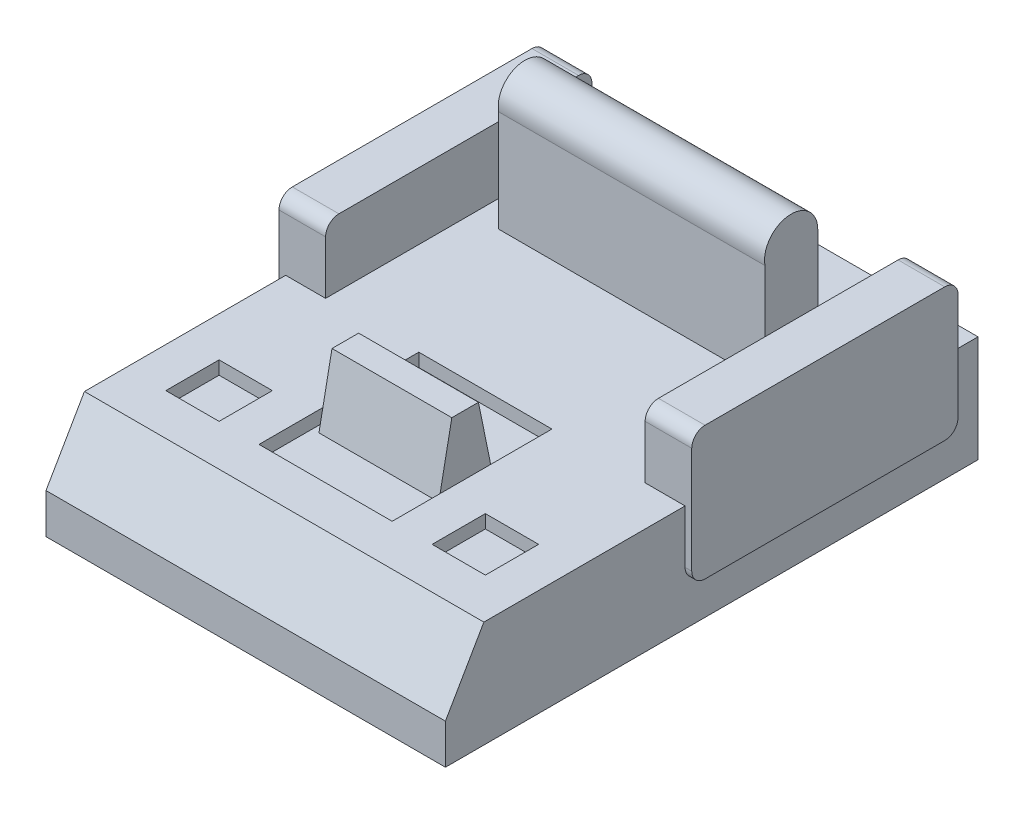
from build123d import *

# Parameters (mm, degrees)
SKETCH_1_W           = 30
SKETCH_1_H           = 40
EXTRUDE_1_DEPTH      = 8
CHAMFER_1_SIZE       = 5
CHAMFER_1_SIZE2      = 2.886751346
EXTRUDE_START        = -3
EXTRUDE_2_DEPTH      = 3.5
EXTRUDE_3_DEPTH      = 10
EXTRUDE_3_DEPTH_BACK = 10
SKETCH_4_W           = 4
SKETCH_4_H           = 4
CUT_EXTRUDE_2_DEPTH  = 1
SKETCH_12_W          = 10
SKETCH_12_H          = 12
CUT_EXTRUDE_3_DEPTH  = 1


with BuildPart() as part:
    # 草图1 → 凸台-拉伸1 (new body)
    with BuildSketch(Plane(origin=(0, 0, 0), x_dir=(1, 0, 0), z_dir=(0, 1, 0))):
        Rectangle(SKETCH_1_W, SKETCH_1_H)
    extrude(amount=EXTRUDE_1_DEPTH)

    # 倒角1
    chamfer_1_edges = [part.edges().sort_by_distance(p)[0] for p in [
        (0, 8, 20),
    ]]
    chamfer_1_side = [part.faces().sort_by_distance(p)[0] for p in [
        (0, 4, 20),
    ]]
    chamfer(chamfer_1_edges, length=CHAMFER_1_SIZE, length2=CHAMFER_1_SIZE2, reference=chamfer_1_side[0])

    # 草图6 → 凸台-拉伸2 (add)
    with BuildSketch(Plane(origin=(15, 0, 0), x_dir=(0, 0, -1), z_dir=(1, 0, 0)).offset(EXTRUDE_START)):
        with BuildLine():
            Line((18, 12), (18, 4))
            ThreePointArc((18, 4), (17.707106781, 3.292893219), (17, 3))
            Line((17, 3), (-1, 3))
            ThreePointArc((-1, 3), (-1.707106781, 3.292893219), (-2, 4))
            Line((-2, 4), (-2, 12))
            ThreePointArc((-2, 12), (-1.707106781, 12.707106781), (-1, 13))
            Line((-1, 13), (17, 13))
            ThreePointArc((17, 13), (17.707106781, 12.707106781), (18, 12))
        make_face()
    extrude_2 = extrude(amount=EXTRUDE_2_DEPTH)

    # 镜向2: 凸台-拉伸2 across plane
    add(extrude_2.mirror(Plane(origin=(0, 0, 0), x_dir=(0, 0, 1), z_dir=(1, 0, 0))))

    # 草图10 → 凸台-拉伸3 (add, two sides: drawn at the far end of the back side and taken through both)
    with BuildSketch(Plane(origin=(0, 0, 0), x_dir=(0, 0, -1), z_dir=(1, 0, 0)).offset(-EXTRUDE_3_DEPTH_BACK)):
        with BuildLine():
            Line((9, 8), (9, 15.630981347))
            ThreePointArc((9, 15.630981347), (10.780355092, 17.991396878), (12.965661526, 16))
            Line((12.965661526, 16), (12.965661526, 8))
            Line((12.965661526, 8), (9, 8))
        make_face()
    extrude(amount=EXTRUDE_3_DEPTH + EXTRUDE_3_DEPTH_BACK)

    # 草图4 → 切除-拉伸2 (cut)
    with BuildSketch(Plane(origin=(0, 8, 0), x_dir=(1, 0, 0), z_dir=(0, 1, 0))):
        with Locations((-10, -12)):
            Rectangle(SKETCH_4_W, SKETCH_4_H)
        with Locations((10, -12)):
            Rectangle(SKETCH_4_W, SKETCH_4_H)
    extrude(amount=-CUT_EXTRUDE_2_DEPTH, mode=Mode.SUBTRACT)

    # 草图12 → 切除-拉伸3 (cut)
    with BuildSketch(Plane(origin=(0, 8, 0), x_dir=(1, 0, 0), z_dir=(0, 1, 0))):
        with Locations((0, -8)):
            Rectangle(SKETCH_12_W, SKETCH_12_H)
    extrude(amount=-CUT_EXTRUDE_3_DEPTH, mode=Mode.SUBTRACT)

    # 草图14 → 放样3 section 0
    with BuildSketch(Plane(origin=(0, 12, 0), x_dir=(1, 0, 0), z_dir=(0, 1, 0))):
        with BuildLine():
            Line((-4.5, -7.020034464), (4.5, -7.020034464))
            Line((4.5, -7.020034464), (4.5, -9.020034464))
            Line((4.5, -9.020034464), (-4.5, -9.020034464))
            Line((-4.5, -9.020034464), (-4.5, -7.020034464))
        make_face()
    # 草图13 → 放样3 section 1
    with BuildSketch(Plane(origin=(0, 7, 0), x_dir=(1, 0, 0), z_dir=(0, 1, 0))):
        with BuildLine():
            Line((-4.5, -10), (4.5, -10))
            Line((4.5, -10), (4.5, -6))
            Line((4.5, -6), (-4.5, -6))
            Line((-4.5, -6), (-4.5, -10))
        make_face()
    loft()


solid = part.part
